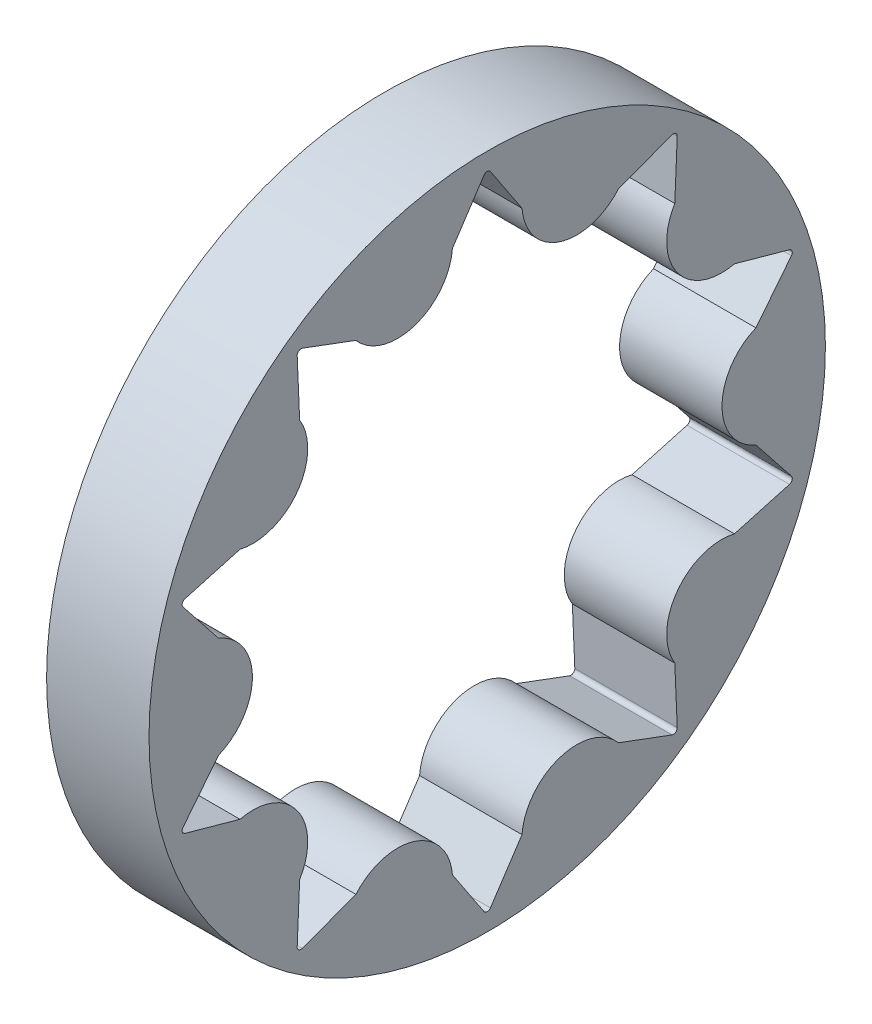
from build123d import *

# Parameters (mm, degrees)
BOSS_EXTRUDE1_DEPTH     = 5.3
CIRPATTERN1_COUNT       = 10
FILLET1_R               = 0.2
FILLET3_R               = 0.2
SKETCH2_R               = 10
SKETCH2_R_2             = 4.05
BOSS_EXTRUDE2_DEPTH     = 16.7
CUT_EXTRUDE1_DEPTH      = 29.341701561
CUT_EXTRUDE1_DEPTH_BACK = 29.341701561
SKETCH2_2_R             = 4.05
SKETCH3_R               = 17.5
BOSS_EXTRUDE3_DEPTH     = 5.3
SKETCH3_3_R             = 17.5
CUT_EXTRUDE2_DEPTH      = 34.11344138


with BuildPart() as part:
    # Sketch1 → Boss-Extrude1 (new body)
    with BuildSketch(Plane(origin=(0, 0, 0), x_dir=(0, 0, -1), z_dir=(1, 0, 0))):
        with BuildLine():
            Line((0, 0), (9.845402976, 13.551034656))
            Line((9.845402976, 13.551034656), (6.793214092, 12.412684734))
            ThreePointArc((6.793214092, 12.412684734), (3.754556482, 11.555336673), (1.800167381, 14.035023954))
            Line((1.800167381, 14.035023954), (0, 16.75))
            Line((0, 16.75), (0, 0))
        make_face()
    boss_extrude1 = extrude(amount=BOSS_EXTRUDE1_DEPTH)

    # CirPattern1: Boss-Extrude1 ×10 about axis
    cirpattern1_axis = Axis((5.3, 0, 0), (-1, 0, 0))
    for i in range(1, CIRPATTERN1_COUNT):
        add(boss_extrude1.rotate(cirpattern1_axis, i * 360 / CIRPATTERN1_COUNT))

    # Fillet1
    fillet1_edges = [part.edges().sort_by_distance(p)[0] for p in [
        (2.65, 16.75, 0),
    ]]
    fillet(fillet1_edges, radius=FILLET1_R)

    # Fillet3
    fillet3_edges = [part.edges().sort_by_distance(p)[0] for p in [
        (2.65, 13.551034656, 9.845402976),
        (2.65, 5.176034656, 15.930196648),
        (2.65, -5.176034656, 15.930196648),
        (2.65, -13.551034656, 9.845402976),
        (2.65, -16.75, 0),
        (2.65, -13.551034656, -9.845402976),
        (2.65, -5.176034656, -15.930196648),
        (2.65, 5.176034656, -15.930196648),
        (2.65, 13.551034656, -9.845402976),
    ]]
    fillet(fillet3_edges, radius=FILLET3_R)

    # Sketch2 → Boss-Extrude2 (add)
    with BuildSketch(Plane.ZY):
        Circle(SKETCH2_R)
        Circle(SKETCH2_R_2, mode=Mode.SUBTRACT)
    extrude(amount=BOSS_EXTRUDE2_DEPTH)

    # Sketch2<2> → Cut-Extrude1 (cut, two sides: drawn at the far end of the back side and taken through both)
    with BuildSketch(Plane.ZY.offset(-CUT_EXTRUDE1_DEPTH_BACK)):
        Circle(SKETCH2_2_R)
    extrude(amount=CUT_EXTRUDE1_DEPTH + CUT_EXTRUDE1_DEPTH_BACK, mode=Mode.SUBTRACT)

    # Sketch3<3> → Cut-Extrude2 (cut, through all)
    with BuildSketch(Plane(origin=(5.3, 0, 0), x_dir=(0, 0, -1), z_dir=(1, 0, 0))):
        Circle(SKETCH3_3_R)
    extrude(amount=-CUT_EXTRUDE2_DEPTH, mode=Mode.SUBTRACT)


with BuildPart() as body_2:
    # Sketch3 → Boss-Extrude3 (new body)
    with BuildSketch(Plane(origin=(5.3, 0, 0), x_dir=(0, 0, -1), z_dir=(1, 0, 0))):
        Circle(SKETCH3_R)
        with BuildLine():
            Line((-9.562783501, 13.445628382), (-6.793214092, 12.412684734))
            ThreePointArc((-6.793214092, 12.412684734), (-3.754556482, 11.555336673), (-1.800167381, 14.035023954))
            Line((-1.800167381, 14.035023954), (-0.166687705, 16.498604974))
            ThreePointArc((-0.166687705, 16.498604974), (0, 16.588082537), (0.166687705, 16.498604974))
            Line((0.166687705, 16.498604974), (1.800167381, 14.035023954))
            ThreePointArc((1.800167381, 14.035023954), (3.754556482, 11.555336673), (6.793214092, 12.412684734))
            Line((6.793214092, 12.412684734), (9.562783501, 13.445628382))
            ThreePointArc((9.562783501, 13.445628382), (9.750230279, 13.420040677), (9.832489873, 13.249675233))
            Line((9.832489873, 13.249675233), (9.7059461, 10.296461057))
            ThreePointArc((9.7059461, 10.296461057), (9.829556482, 7.141590815), (12.791818675, 6.049121837))
            Line((12.791818675, 6.049121837), (15.639596437, 5.256878748))
            ThreePointArc((15.639596437, 5.256878748), (15.77620399, 5.125999408), (15.742615104, 4.939819893))
            Line((15.742615104, 4.939819893), (13.904383302, 2.625))
            ThreePointArc((13.904383302, 2.625), (12.15, 0), (13.904383302, -2.625))
            Line((13.904383302, -2.625), (15.742615104, -4.939819893))
            ThreePointArc((15.742615104, -4.939819893), (15.77620399, -5.125999408), (15.639596437, -5.256878748))
            Line((15.639596437, -5.256878748), (12.791818675, -6.049121837))
            ThreePointArc((12.791818675, -6.049121837), (9.829556482, -7.141590815), (9.7059461, -10.296461057))
            Line((9.7059461, -10.296461057), (9.832489873, -13.249675233))
            ThreePointArc((9.832489873, -13.249675233), (9.750230279, -13.420040677), (9.562783501, -13.445628382))
            Line((9.562783501, -13.445628382), (6.793214092, -12.412684734))
            ThreePointArc((6.793214092, -12.412684734), (3.754556482, -11.555336673), (1.800167381, -14.035023954))
            Line((1.800167381, -14.035023954), (0.166687705, -16.498604974))
            ThreePointArc((0.166687705, -16.498604974), (0, -16.588082537), (-0.166687705, -16.498604974))
            Line((-0.166687705, -16.498604974), (-1.800167381, -14.035023954))
            ThreePointArc((-1.800167381, -14.035023954), (-3.754556482, -11.555336673), (-6.793214092, -12.412684734))
            Line((-6.793214092, -12.412684734), (-9.562783501, -13.445628382))
            ThreePointArc((-9.562783501, -13.445628382), (-9.750230279, -13.420040677), (-9.832489873, -13.249675233))
            Line((-9.832489873, -13.249675233), (-9.7059461, -10.296461057))
            ThreePointArc((-9.7059461, -10.296461057), (-9.829556482, -7.141590815), (-12.791818675, -6.049121837))
            Line((-12.791818675, -6.049121837), (-15.639596437, -5.256878748))
            ThreePointArc((-15.639596437, -5.256878748), (-15.77620399, -5.125999408), (-15.742615104, -4.939819893))
            Line((-15.742615104, -4.939819893), (-13.904383302, -2.625))
            ThreePointArc((-13.904383302, -2.625), (-12.15, 0), (-13.904383302, 2.625))
            Line((-13.904383302, 2.625), (-15.742615104, 4.939819893))
            ThreePointArc((-15.742615104, 4.939819893), (-15.77620399, 5.125999408), (-15.639596437, 5.256878748))
            Line((-15.639596437, 5.256878748), (-12.791818675, 6.049121837))
            ThreePointArc((-12.791818675, 6.049121837), (-9.829556482, 7.141590815), (-9.7059461, 10.296461057))
            Line((-9.7059461, 10.296461057), (-9.832489873, 13.249675233))
            ThreePointArc((-9.832489873, 13.249675233), (-9.750230279, 13.420040677), (-9.562783501, 13.445628382))
        make_face(mode=Mode.SUBTRACT)
    extrude(amount=BOSS_EXTRUDE3_DEPTH)


solid = body_2.part
